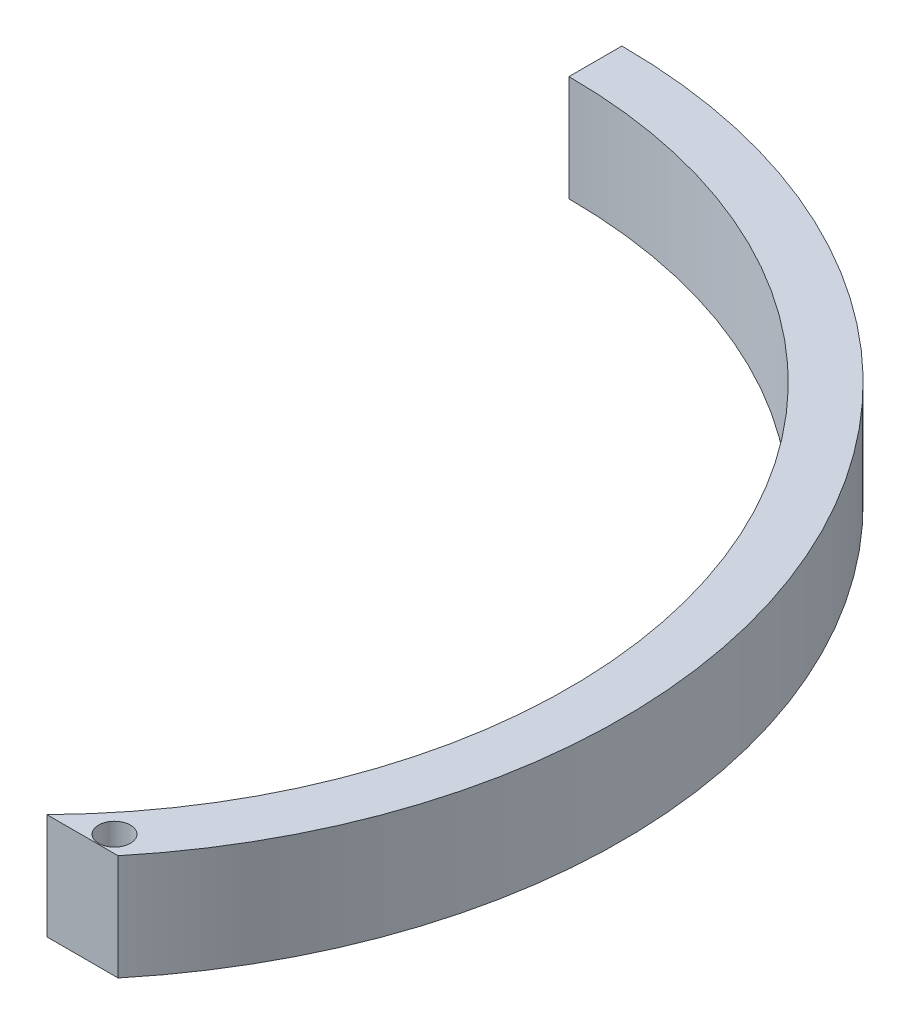
from build123d import *

# Parameters (mm, degrees)
SKETCH1_R           = 1.5
BOSS_EXTRUDE2_DEPTH = 10


with BuildPart() as part:
    # Sketch1 → Boss-Extrude2 (new body)
    with BuildSketch(Plane(origin=(0, 0, 0), x_dir=(1, 0, 0), z_dir=(0, 1, 0))):
        with BuildLine():
            Line((0, 50), (0, 55))
            ThreePointArc((0, 55), (49.749371855, 23.452078799), (42.426406871, -35))
            Line((42.426406871, -35), (35.707142143, -35))
            ThreePointArc((35.707142143, -35), (46.097722286, 19.364916731), (0, 50))
        make_face()
        with Locations(Location((40.497933832, -33.409090909, 0), (0, 0, 270))):
            Circle(SKETCH1_R, mode=Mode.SUBTRACT)
    extrude(amount=BOSS_EXTRUDE2_DEPTH)


solid = part.part
